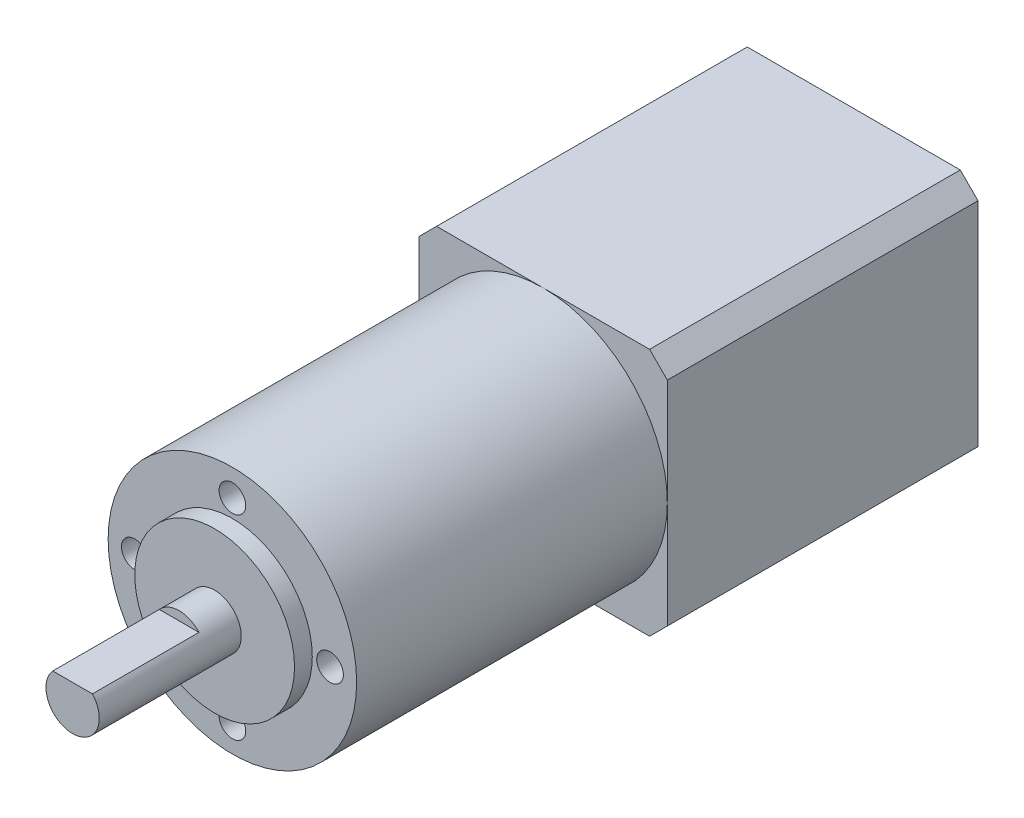
from build123d import *

# Parameters (mm, degrees)
SKETCH1_W           = 28
SKETCH1_H           = 28
BOSS_EXTRUDE1_DEPTH = 35
SKETCH2_R           = 14
BOSS_EXTRUDE2_DEPTH = 35
SKETCH3_R           = 9
BOSS_EXTRUDE3_DEPTH = 2
SKETCH4_R           = 3
BOSS_EXTRUDE4_DEPTH = 16
CUT_EXTRUDE1_START  = -12
CUT_EXTRUDE1_DEPTH  = 12
SKETCH6_R           = 1.5
CUT_EXTRUDE2_DEPTH  = 2
SKETCH7_R           = 2.5
BOSS_EXTRUDE5_DEPTH = 9.5
CHAMFER1_SIZE       = 2
SKETCH8_R           = 1.5
CUT_EXTRUDE3_DEPTH  = 5


with BuildPart() as part:
    # Sketch1 → Boss-Extrude1 (new body)
    with BuildSketch(Plane.XY):
        Rectangle(SKETCH1_W, SKETCH1_H)
    extrude(amount=BOSS_EXTRUDE1_DEPTH)

    # Sketch2 → Boss-Extrude2 (add)
    with BuildSketch(Plane.XY.offset(35)):
        Circle(SKETCH2_R)
    extrude(amount=BOSS_EXTRUDE2_DEPTH)

    # Sketch3 → Boss-Extrude3 (add)
    with BuildSketch(Plane.XY.offset(70)):
        Circle(SKETCH3_R)
    extrude(amount=BOSS_EXTRUDE3_DEPTH)

    # Sketch4 → Boss-Extrude4 (add)
    with BuildSketch(Plane.XY.offset(72)):
        Circle(SKETCH4_R)
    extrude(amount=BOSS_EXTRUDE4_DEPTH)

    # Sketch5 → Cut-Extrude1 (cut)
    with BuildSketch(Plane.XY.offset(88).offset(CUT_EXTRUDE1_START)):
        with BuildLine():
            Line((-2.236067977, 2), (2.236067977, 2))
            ThreePointArc((2.236067977, 2), (0, 3), (-2.236067977, 2))
        make_face()
    extrude(amount=CUT_EXTRUDE1_DEPTH, mode=Mode.SUBTRACT)

    # Sketch6 → Cut-Extrude2 (cut)
    with BuildSketch(Plane(origin=(0, 0, 0), x_dir=(-1, 0, 0), z_dir=(0, 0, -1))):
        with Locations((9.5, 0)):
            Circle(SKETCH6_R)
        with Locations(Location((-9.5, 0, 0), (0, 0, 180))):
            Circle(SKETCH6_R)
    extrude(amount=-CUT_EXTRUDE2_DEPTH, mode=Mode.SUBTRACT)

    # Sketch7 → Boss-Extrude5 (add)
    with BuildSketch(Plane(origin=(0, 0, 0), x_dir=(-1, 0, 0), z_dir=(0, 0, -1))):
        Circle(SKETCH7_R)
    extrude(amount=BOSS_EXTRUDE5_DEPTH)

    # Chamfer1
    chamfer1_edges = [part.edges().sort_by_distance(p)[0] for p in [
        (14, -14, 17.5),
        (-14, -14, 17.5),
        (-14, 14, 17.5),
        (14, 14, 17.5),
    ]]
    chamfer(chamfer1_edges, length=CHAMFER1_SIZE)

    # Sketch8 → Cut-Extrude3 (cut)
    with BuildSketch(Plane.XY.offset(70)):
        with Locations((0, 11)):
            Circle(SKETCH8_R)
        with Locations((11, 0)):
            Circle(SKETCH8_R)
        with Locations((0, -11)):
            Circle(SKETCH8_R)
        with Locations((-11, 0)):
            Circle(SKETCH8_R)
    extrude(amount=-CUT_EXTRUDE3_DEPTH, mode=Mode.SUBTRACT)


solid = part.part
